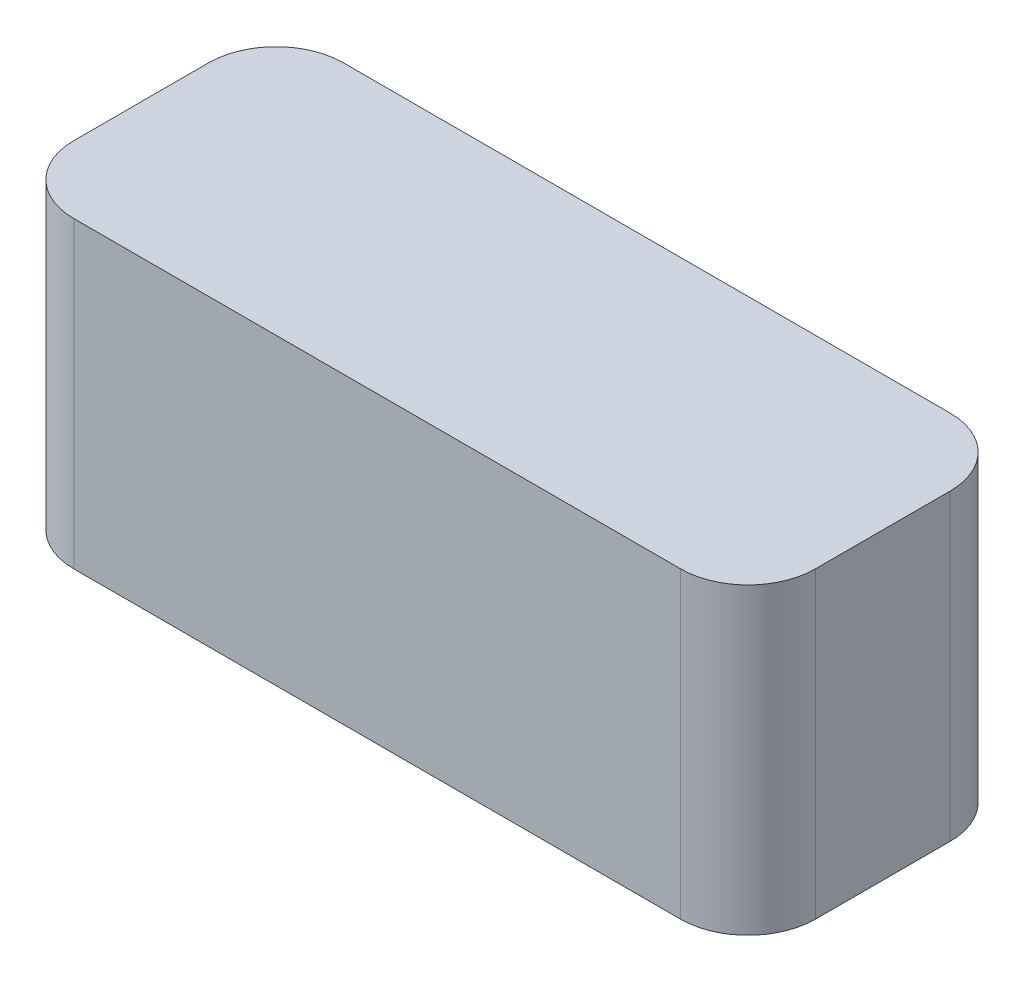
from build123d import *

# Parameters (mm, degrees)
ESQUISSE1_W        = 110
ESQUISSE1_H        = 45
BOSS_EXTRU_1_DEPTH = 40
CONG_1_R           = 10
CONG_2_R           = 10
CONG_3_R           = 10
CONG_4_R           = 10


with BuildPart() as part:
    # Esquisse1 → Boss.-Extru.1 (new body)
    with BuildSketch(Plane.XY):
        with Locations((55, 22.5)):
            Rectangle(ESQUISSE1_W, ESQUISSE1_H)
    extrude(amount=BOSS_EXTRU_1_DEPTH)

    # Congé1
    cong_1_edges = [part.edges().sort_by_distance(p)[0] for p in [
        (0, 22.5, 40),
    ]]
    fillet(cong_1_edges, radius=CONG_1_R)

    # Congé2
    cong_2_edges = [part.edges().sort_by_distance(p)[0] for p in [
        (110, 22.5, 40),
    ]]
    fillet(cong_2_edges, radius=CONG_2_R)

    # Congé3
    cong_3_edges = [part.edges().sort_by_distance(p)[0] for p in [
        (110, 22.5, 0),
    ]]
    fillet(cong_3_edges, radius=CONG_3_R)

    # Congé4
    cong_4_edges = [part.edges().sort_by_distance(p)[0] for p in [
        (0, 22.5, 0),
    ]]
    fillet(cong_4_edges, radius=CONG_4_R)


solid = part.part
